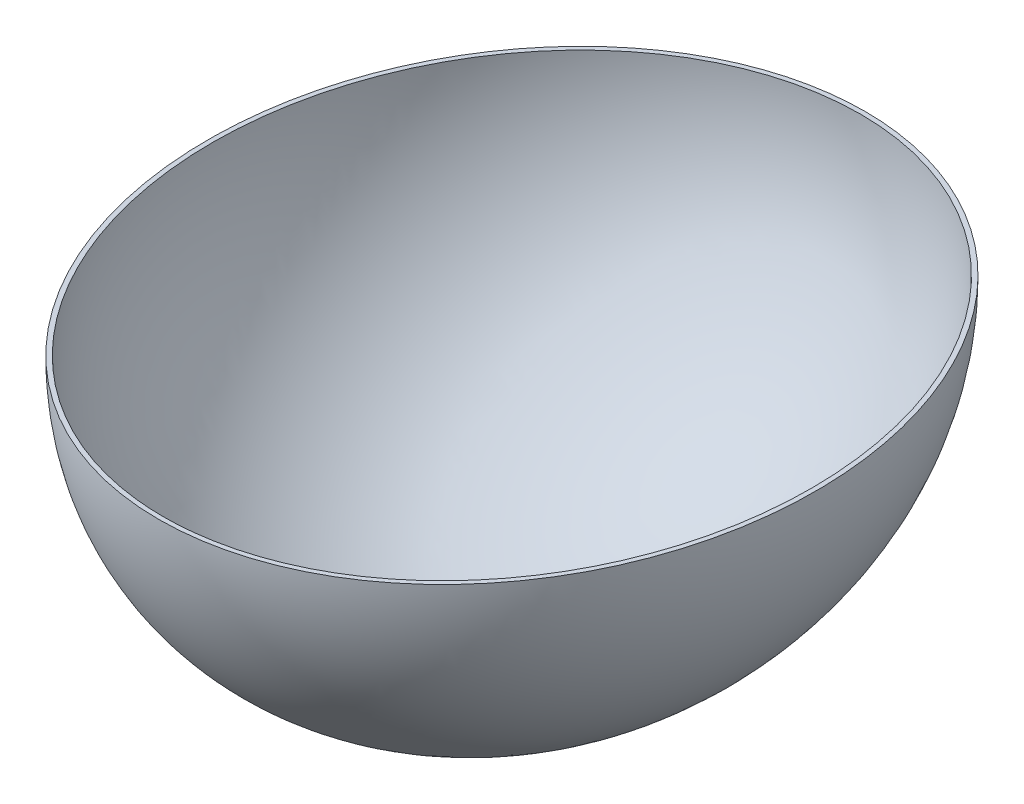
from build123d import *

# Parameters (mm, degrees)
REVOLVE1_ANGLE = 180


with BuildPart() as part:
    # Sketch1 → Revolve1 (revolve)
    with BuildSketch(Plane(origin=(0, 0, 0), x_dir=(1, 0, 0), z_dir=(0, 1, 0))):
        with BuildLine():
            Line((0, 230), (0, 227))
            add(Edge.make_bspline(
                [(0, -227), (12.733369847, -227), (38.191604546, -224.087476047), (74.944322244, -211.139596551), (108.854613664, -190.087807002), (138.6180047, -161.717808596), (163.074756003, -127.104792386), (181.266004736, -87.574946287), (192.47575539, -44.652910216), (196.262122305, 0), (192.47575539, 44.652910216), (181.266004736, 87.574946287), (163.074756003, 127.104792386), (138.6180047, 161.717808596), (108.854613664, 190.087807002), (74.944322244, 211.139596551), (38.191604546, 224.087476047), (12.733369847, 227), (0, 227)],
                knots=[-3.141592654, -3.141592654, -3.141592654, -3.141592654, -2.945243113, -2.748893572, -2.552544031, -2.35619449, -2.159844949, -1.963495408, -1.767145868, -1.570796327, -1.374446786, -1.178097245, -0.981747704, -0.785398163, -0.589048623, -0.392699082, -0.196349541, 0, 0, 0, 0], degree=3))
            Line((0, -227), (0, -230))
            add(Edge.make_bspline(
                [(0, -230), (198, -230), (198, 0), (198, 230), (0, 230)],
                knots=[3.141592654, 3.141592654, 3.141592654, 4.71238898, 4.71238898, 6.283185307, 6.283185307, 6.283185307], degree=2, weights=[1, 0.707106781, 1, 0.707106781, 1]))
        make_face()
    revolve(axis=Axis((0, 0, 0), (0, 0, -1)), revolution_arc=REVOLVE1_ANGLE)


solid = part.part
